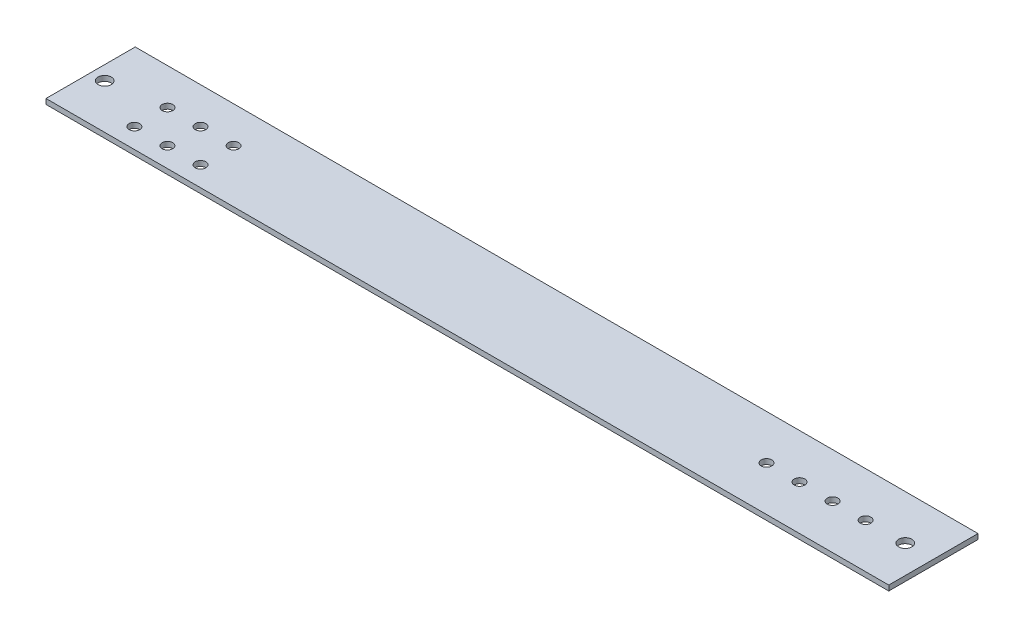
from build123d import *

# Parameters (mm, degrees)
SKETCH1_W           = 64.77
SKETCH1_H           = 6.858
BOSS_EXTRUDE1_DEPTH = 0.4
SKETCH2_R           = 0.4064
SKETCH2_R_2         = 0.508
CUT_EXTRUDE1_DEPTH  = 66.133286912


with BuildPart() as part:
    # Sketch1 → Boss-Extrude1 (new body)
    with BuildSketch(Plane(origin=(0, 0, 0), x_dir=(1, 0, 0), z_dir=(0, 1, 0))):
        with Locations((32.385, 3.429)):
            Rectangle(SKETCH1_W, SKETCH1_H)
    extrude(amount=BOSS_EXTRUDE1_DEPTH)

    # Sketch2 → Cut-Extrude1 (cut, through all)
    with BuildSketch(Plane(origin=(0, 0.4, 0), x_dir=(1, 0, 0), z_dir=(0, 1, 0))):
        with Locations(Location((51.943, 3.429, 0), (0, 0, 270))):
            Circle(SKETCH2_R)
        with Locations(Location((54.483, 3.429, 0), (0, 0, 270))):
            Circle(SKETCH2_R)
        with Locations(Location((57.023, 3.429, 0), (0, 0, 270))):
            Circle(SKETCH2_R)
        with Locations(Location((59.563, 3.429, 0), (0, 0, 270))):
            Circle(SKETCH2_R)
        with Locations(Location((62.611, 3.429, 0), (0, 0, 270))):
            Circle(SKETCH2_R_2)
        with Locations(Location((10.3505, 4.064, 0), (0, 0, 270))):
            Circle(SKETCH2_R)
        with Locations(Location((7.8105, 4.064, 0), (0, 0, 270))):
            Circle(SKETCH2_R)
        with Locations(Location((5.2705, 4.064, 0), (0, 0, 270))):
            Circle(SKETCH2_R)
        with Locations(Location((7.8105, 1.524, 0), (0, 0, 270))):
            Circle(SKETCH2_R)
        with Locations(Location((5.2705, 1.524, 0), (0, 0, 270))):
            Circle(SKETCH2_R)
        with Locations(Location((10.3505, 1.524, 0), (0, 0, 270))):
            Circle(SKETCH2_R)
        with Locations(Location((1.0795, 3.429, 0), (0, 0, 270))):
            Circle(SKETCH2_R_2)
    extrude(amount=-CUT_EXTRUDE1_DEPTH, mode=Mode.SUBTRACT)


solid = part.part
